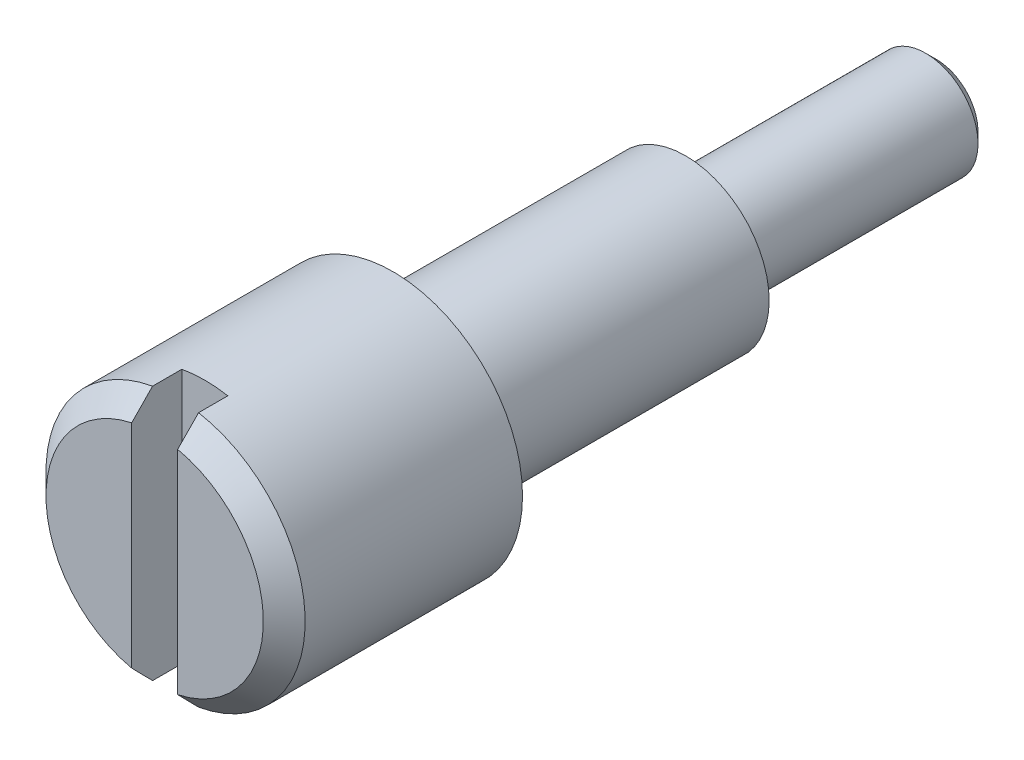
from build123d import *

# Parameters (mm, degrees)
SKETCH_1_R          = 3.1
EXTRUDE_1_DEPTH     = 5.7
SKETCH_2_R          = 2
EXTRUDE_2_DEPTH     = 7
SKETCH_3_R          = 1.25
EXTRUDE_3_DEPTH     = 6
CHAMFER_1_SIZE      = 0.2535
CHAMFER_2_SIZE      = 0.5
SKETCH_5_W          = 1.1
SKETCH_5_H          = 7
CUT_EXTRUDE_1_DEPTH = 1.2


with BuildPart() as part:
    # Эскиз1 → Бобышка-Вытянуть1 (new body)
    with BuildSketch(Plane.XY):
        Circle(SKETCH_1_R)
    extrude(amount=EXTRUDE_1_DEPTH)

    # Эскиз2 → Бобышка-Вытянуть2 (add)
    with BuildSketch(Plane(origin=(0, 0, 0), x_dir=(-1, 0, 0), z_dir=(0, 0, -1))):
        with Locations(Location((0, 0, 0), (0, 0, 180))):
            Circle(SKETCH_2_R)
    extrude(amount=EXTRUDE_2_DEPTH)

    # Эскиз3 → Бобышка-Вытянуть3 (add)
    with BuildSketch(Plane(origin=(0, 0, -7), x_dir=(-1, 0, 0), z_dir=(0, 0, -1))):
        Circle(SKETCH_3_R)
    extrude(amount=EXTRUDE_3_DEPTH)

    # Фаска1
    chamfer_1_edges = [part.edges().sort_by_distance(p)[0] for p in [
        (1.25, 0, -13),
    ]]
    chamfer(chamfer_1_edges, length=CHAMFER_1_SIZE)

    # Фаска2
    chamfer_2_edges = [part.edges().sort_by_distance(p)[0] for p in [
        (-3.1, 0, 5.7),
    ]]
    chamfer(chamfer_2_edges, length=CHAMFER_2_SIZE)

    # Эскиз5 → Вырез-Вытянуть1 (cut)
    with BuildSketch(Plane.XY.offset(5.7)):
        Rectangle(SKETCH_5_W, SKETCH_5_H)
    extrude(amount=-CUT_EXTRUDE_1_DEPTH, mode=Mode.SUBTRACT)


solid = part.part
